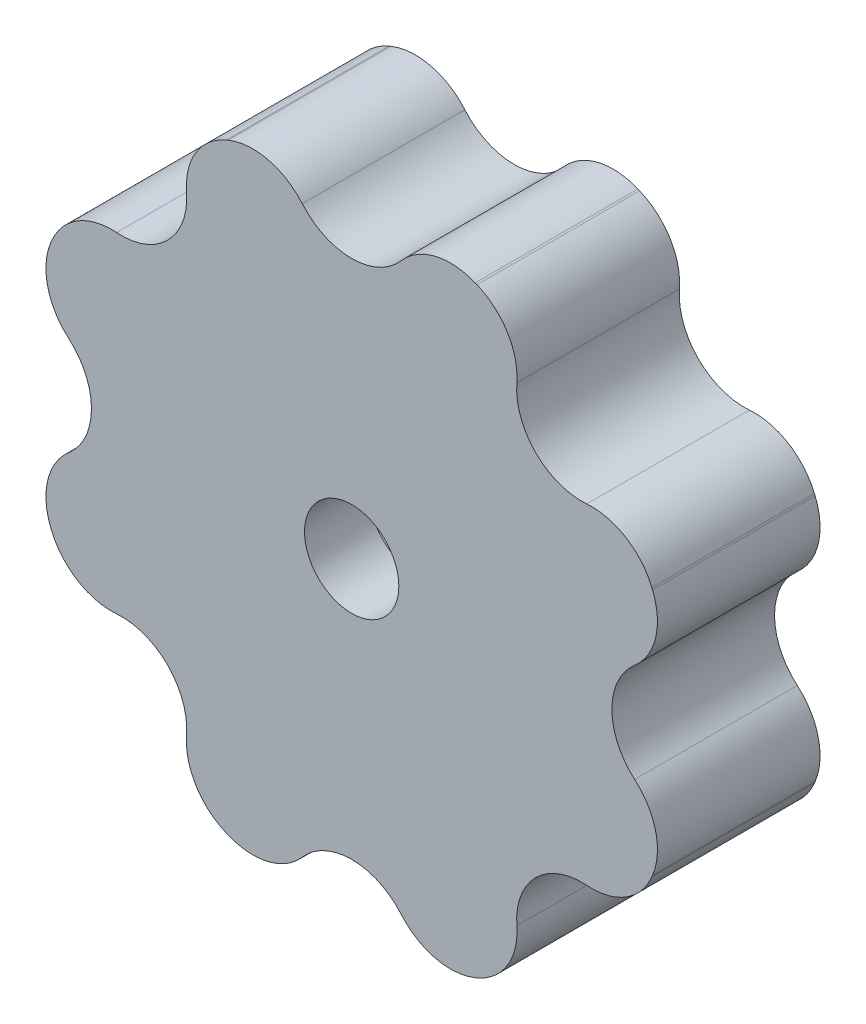
from build123d import *

# Parameters (mm, degrees)
SKETCH_1_R          = 1.45
EXTRUDE_1_DEPTH     = 5
FILLET_2_R          = 2
CUT_EXTRUDE_1_DEPTH = 3


with BuildPart() as part:
    # Эскиз1 → Бобышка-Вытянуть1 (new body)
    with BuildSketch(Plane.XY):
        with BuildLine():
            ThreePointArc((9.8, -1.989974874), (8, 0), (9.8, 1.989974874))
            ThreePointArc((9.8, 1.989974874), (9.238795325, 3.826834324), (8.336771184, 5.522521728))
            ThreePointArc((8.336771184, 5.522521728), (5.656854249, 5.656854249), (5.522521728, 8.336771184))
            ThreePointArc((5.522521728, 8.336771184), (3.826834324, 9.238795325), (1.989974874, 9.8))
            ThreePointArc((1.989974874, 9.8), (0, 8), (-1.989974874, 9.8))
            ThreePointArc((-1.989974874, 9.8), (-3.826834324, 9.238795325), (-5.522521728, 8.336771184))
            ThreePointArc((-5.522521728, 8.336771184), (-5.656854249, 5.656854249), (-8.336771184, 5.522521728))
            ThreePointArc((-8.336771184, 5.522521728), (-9.238795325, 3.826834324), (-9.8, 1.989974874))
            ThreePointArc((-9.8, 1.989974874), (-8, 0), (-9.8, -1.989974874))
            ThreePointArc((-9.8, -1.989974874), (-9.238795325, -3.826834324), (-8.336771184, -5.522521728))
            ThreePointArc((-8.336771184, -5.522521728), (-5.656854249, -5.656854249), (-5.522521728, -8.336771184))
            ThreePointArc((-5.522521728, -8.336771184), (-3.826834324, -9.238795325), (-1.989974874, -9.8))
            ThreePointArc((-1.989974874, -9.8), (0, -8), (1.989974874, -9.8))
            ThreePointArc((1.989974874, -9.8), (3.826834324, -9.238795325), (5.522521728, -8.336771184))
            ThreePointArc((5.522521728, -8.336771184), (5.656854249, -5.656854249), (8.336771184, -5.522521728))
            ThreePointArc((8.336771184, -5.522521728), (9.238795325, -3.826834324), (9.8, -1.989974874))
        make_face()
        Circle(SKETCH_1_R, mode=Mode.SUBTRACT)
    extrude(amount=EXTRUDE_1_DEPTH)

    # Скругление2
    fillet_2_edges = [part.edges().sort_by_distance(p)[0] for p in [
        (-5.522521728, 8.336771184, 2.5),
        (-1.989974874, 9.8, 2.5),
        (1.989974874, 9.8, 2.5),
        (5.522521728, 8.336771184, 2.5),
        (8.336771184, 5.522521728, 2.5),
        (9.8, 1.989974874, 2.5),
        (9.8, -1.989974874, 2.5),
        (8.336771184, -5.522521728, 2.5),
        (5.522521728, -8.336771184, 2.5),
        (1.989974874, -9.8, 2.5),
        (-1.989974874, -9.8, 2.5),
        (-5.522521728, -8.336771184, 2.5),
        (-8.336771184, -5.522521728, 2.5),
        (-9.8, -1.989974874, 2.5),
        (-9.8, 1.989974874, 2.5),
        (-8.336771184, 5.522521728, 2.5),
    ]]
    fillet(fillet_2_edges, radius=FILLET_2_R)

    # Эскиз2 → Вырез-Вытянуть1 (cut)
    with BuildSketch(Plane(origin=(0, 0, 0), x_dir=(-1, 0, 0), z_dir=(0, 0, -1))):
        Polygon((0, 3.175426481), (-2.75, 1.58771324), (-2.75, -1.58771324), (0, -3.175426481), (2.75, -1.58771324), (2.75, 1.58771324), align=None)
    extrude(amount=-CUT_EXTRUDE_1_DEPTH, mode=Mode.SUBTRACT)


solid = part.part
